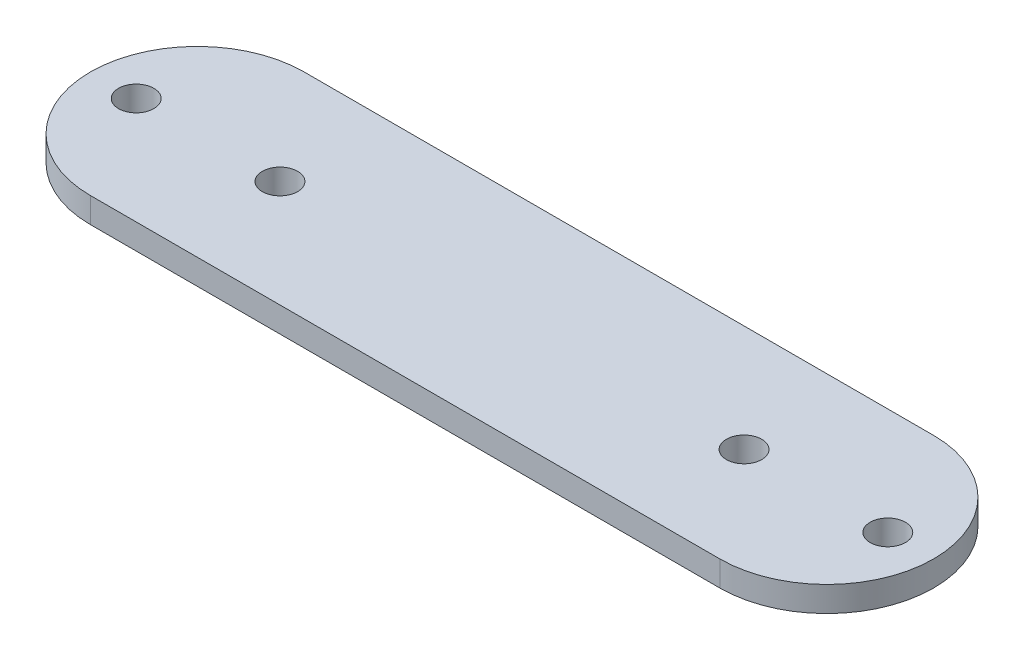
from build123d import *

# Parameters (mm, degrees)
BOSS_EXTRUDE1_DEPTH = 2.5
SKETCH2_R           = 1.75
CUT_EXTRUDE1_DEPTH  = 44.195485875


with BuildPart() as part:
    # Sketch1 → Boss-Extrude1 (new body)
    with BuildSketch(Plane(origin=(0, 0, 0), x_dir=(1, 0, 0), z_dir=(0, 1, 0))):
        with BuildLine():
            Line((-31.2, 10.6), (31.2, 10.6))
            ThreePointArc((31.2, 10.6), (41.8, 0), (31.2, -10.6))
            Line((31.2, -10.6), (-31.2, -10.6))
            ThreePointArc((-31.2, -10.6), (-41.8, 0), (-31.2, 10.6))
        make_face()
    extrude(amount=BOSS_EXTRUDE1_DEPTH)

    # Sketch2 → Cut-Extrude1 (cut, through all)
    with BuildSketch(Plane(origin=(0, 2.5, 0), x_dir=(1, 0, 0), z_dir=(0, 1, 0))):
        with Locations(Location((-37.25, 0, 0), (0, 0, 270))):
            Circle(SKETCH2_R)
        with Locations(Location((-23, 0, 0), (0, 0, 270))):
            Circle(SKETCH2_R)
        with Locations(Location((23, 0, 0), (0, 0, 270))):
            Circle(SKETCH2_R)
        with Locations(Location((37.25, 0, 0), (0, 0, 270))):
            Circle(SKETCH2_R)
    extrude(amount=-CUT_EXTRUDE1_DEPTH, mode=Mode.SUBTRACT)


solid = part.part
